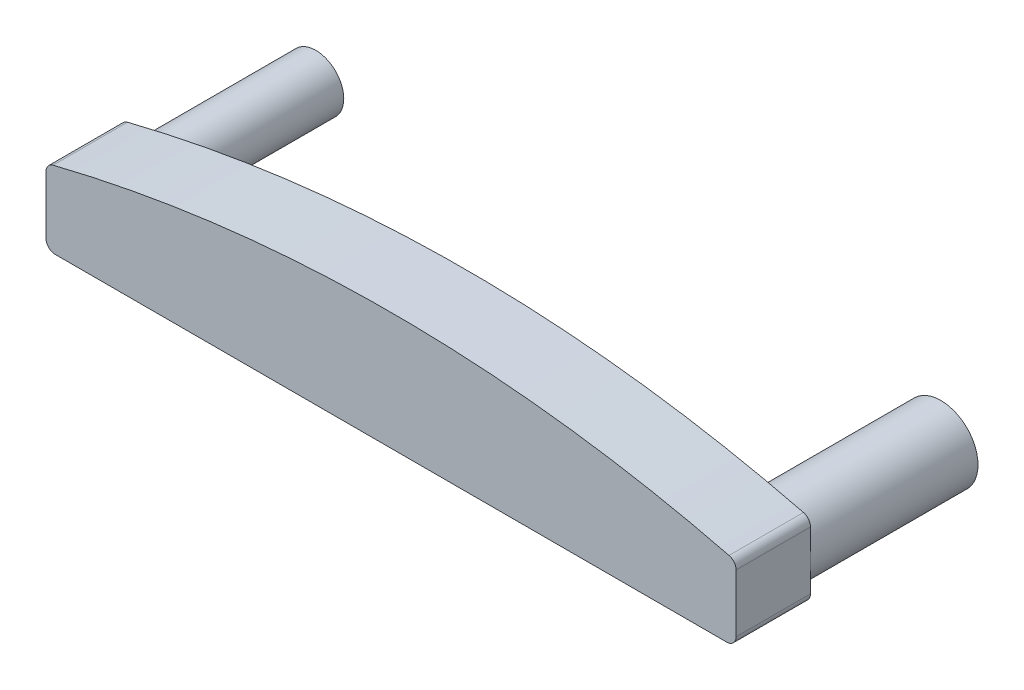
from build123d import *

# Parameters (mm, degrees)
BOSS_EXTRUDE1_DEPTH = 4
SKETCH1_3_R         = 1.5
SKETCH1_3_R_2       = 2
BOSS_EXTRUDE2_DEPTH = 9
FILLET1_R           = 0.5


with BuildPart() as part:
    # Sketch1 → Boss-Extrude1 (new body)
    with BuildSketch(Plane.XY):
        with BuildLine():
            Line((0, 0), (0, -4))
            Line((0, -4), (37.08, -4))
            Line((37.08, -4), (37.08, 0))
            ThreePointArc((37.08, 0), (18.54, 2.327664136), (0, 0))
        make_face()
    extrude(amount=BOSS_EXTRUDE1_DEPTH)

    # Sketch1<3> → Boss-Extrude2 (add)
    with BuildSketch(Plane.XY):
        with Locations((1.5, -2)):
            Circle(SKETCH1_3_R)
        with Locations((35.08, -2)):
            Circle(SKETCH1_3_R_2)
    extrude(amount=-BOSS_EXTRUDE2_DEPTH)

    # Fillet1
    fillet1_edges = [part.edges().sort_by_distance(p)[0] for p in [
        (0, -4, 2),
        (37.08, -4, 2),
        (37.08, 0, 2),
        (0, 0, 2),
    ]]
    fillet(fillet1_edges, radius=FILLET1_R)


solid = part.part
